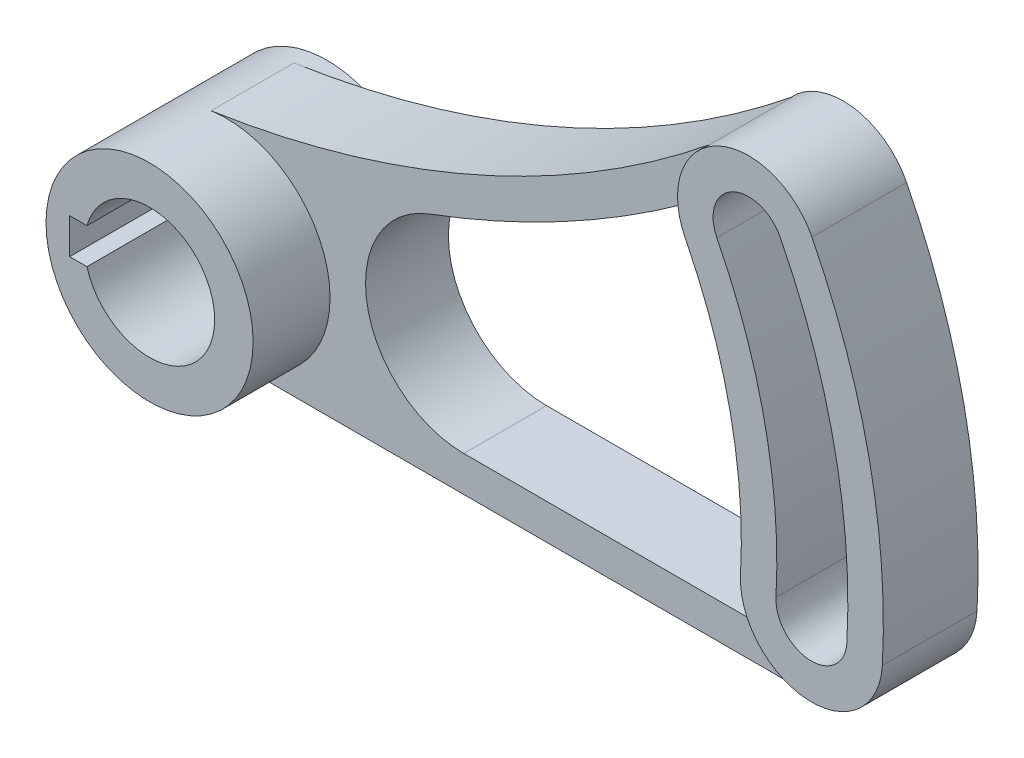
from build123d import *

# Parameters (mm, degrees)
SKETCH1_R           = 17.5
BOSS_EXTRUDE1_DEPTH = 30
BOSS_EXTRUDE2_DEPTH = 7
BOSS_EXTRUDE3_DEPTH = 8


with BuildPart() as part:
    # Sketch1 → Boss-Extrude1 (new body)
    with BuildSketch(Plane.XY):
        Circle(SKETCH1_R)
        with BuildLine():
            Line((-10.583005244, 3), (-13.5, 3))
            Line((-13.5, 3), (-13.5, -3))
            Line((-13.5, -3), (-10.583005244, -3))
            ThreePointArc((-10.583005244, -3), (11, 0), (-10.583005244, 3))
        make_face(mode=Mode.SUBTRACT)
    extrude(amount=BOSS_EXTRUDE1_DEPTH)

    # Sketch2 → Boss-Extrude2 (add, symmetric)
    with BuildSketch(Plane.XY.offset(10)):
        with BuildLine():
            ThreePointArc((-2.601595129, 17.305539656), (17.451317199, 1.304426314), (0, -17.5))
            Line((0, -17.5), (99.848635444, -17.5))
            ThreePointArc((99.848635444, -17.5), (93.848635444, -15.892304845), (89.456330598, -11.5))
            Line((89.456330598, -11.5), (40.096746205, -11.5))
            ThreePointArc((40.096746205, -11.5), (23.76101461, 2.164876864), (34.325225686, 20.65764385))
            ThreePointArc((34.325225686, 20.65764385), (56.599943686, 30.676937705), (77.322925322, 43.603938264))
            ThreePointArc((77.322925322, 43.603938264), (78.075047047, 49.606129473), (81.659593785, 54.478809544))
            ThreePointArc((81.659593785, 54.478809544), (42.018242639, 30.249770758), (-2.601595129, 17.305539656))
        make_face()
    extrude(amount=BOSS_EXTRUDE2_DEPTH, both=True)

    # Sketch2<3> → Boss-Extrude3 (add, symmetric)
    with BuildSketch(Plane.XY.offset(10)):
        with BuildLine():
            ThreePointArc((89.456330598, -11.5), (93.848635444, -15.892304845), (99.848635444, -17.5))
            ThreePointArc((99.848635444, -17.5), (108.097271695, -14.215503428), (111.830471697, -6.16))
            ThreePointArc((111.830471697, -6.16), (109.614266096, 22.993752808), (99.928029407, 50.580519361))
            ThreePointArc((99.928029407, 50.580519361), (91.725745624, 56.896957805), (81.659593785, 54.478809544))
            ThreePointArc((81.659593785, 54.478809544), (78.075047047, 49.606129473), (77.322925322, 43.603938264))
            ThreePointArc((77.322925322, 43.603938264), (77.75512848, 41.622342022), (78.514880248, 39.741836641))
            ThreePointArc((78.514880248, 39.741836641), (86.12549479, 18.066520063), (87.866799191, -4.84))
            ThreePointArc((87.866799191, -4.84), (88.176469943, -8.285776826), (89.456330598, -11.5))
        make_face()
        with BuildLine():
            ThreePointArc((105.83955357, -5.83), (99.518635444, -11.490918127), (93.857717317, -5.17))
            ThreePointArc((93.857717317, -5.17), (91.997687616, 19.29832825), (83.868167538, 42.451507321))
            ThreePointArc((83.868167538, 42.451507321), (86.511784148, 50.514465291), (94.574742117, 47.870848681))
            ThreePointArc((94.574742117, 47.870848681), (103.74207327, 21.761944622), (105.83955357, -5.83))
        make_face(mode=Mode.SUBTRACT)
    extrude(amount=BOSS_EXTRUDE3_DEPTH, both=True)


solid = part.part
